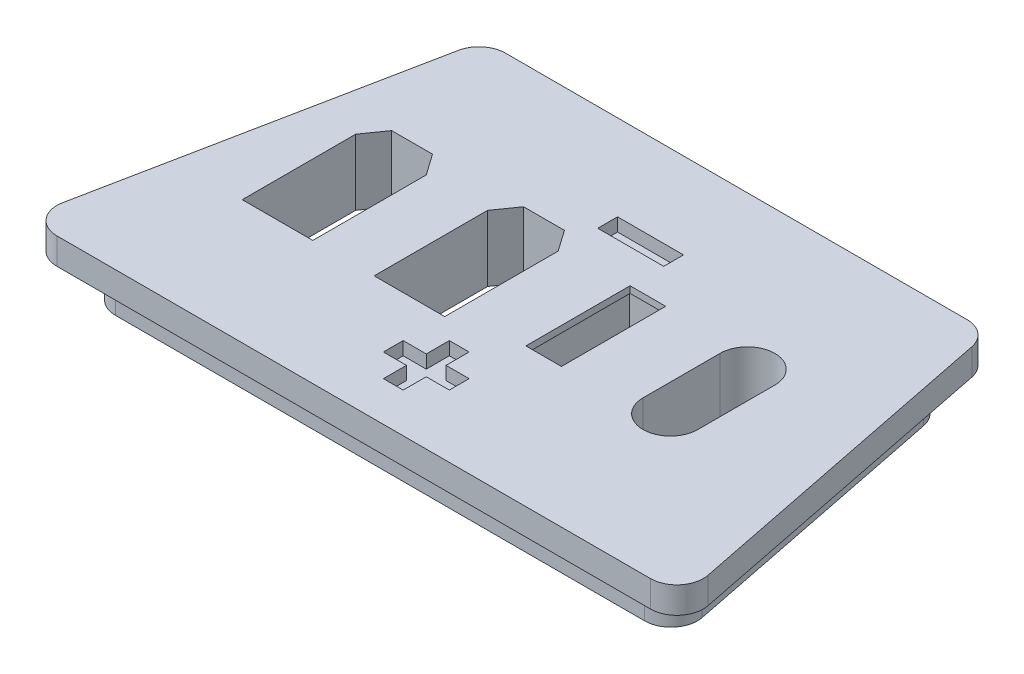
from build123d import *

# Parameters (mm, degrees)
BOSS_EXTRUDE1_DEPTH = 3
BOSS_EXTRUDE2_DEPTH = 2
FILLET1_R           = 2
CUT_EXTRUDE1_DEPTH  = 5
LPATTERN1_COUNT     = 2
LPATTERN1_PITCH     = 10
SKETCH5_W           = 2.7
SKETCH5_H           = 7.9
CUT_EXTRUDE2_DEPTH  = 5
SKETCH6_W           = 3
SKETCH6_H           = 8.1
CUT_EXTRUDE3_DEPTH  = 4.5
USB_C_HOLE_DEPTH    = 5
SKETCH8_W           = 1.75
SKETCH8_H           = 1.5
SKETCH8_W_2         = 1.5
SKETCH8_H_2         = 1.75
SKETCH8_W_3         = 5
POSNEGSIGNS_DEPTH   = 1


with BuildPart() as part:
    # Sketch1 → Boss-Extrude1 (new body)
    with BuildSketch(Plane(origin=(0, 0, 0), x_dir=(1, 0, 0), z_dir=(0, 1, 0))):
        Polygon((-17.5, 12.5), (17.5, 12.5), (22.5, -12.5), (-22.5, -12.5), align=None)
    extrude(amount=BOSS_EXTRUDE1_DEPTH)

    # Sketch2 → Boss-Extrude2 (add)
    with BuildSketch(Plane(origin=(0, 3, 0), x_dir=(1, 0, 0), z_dir=(0, 1, 0))):
        Polygon((-19.139607805, 14.5), (19.139607805, 14.5), (24.939607805, -14.5), (-24.939607805, -14.5), align=None)
    extrude(amount=BOSS_EXTRUDE2_DEPTH)

    # Fillet1
    fillet1_edges = [part.edges().sort_by_distance(p)[0] for p in [
        (-19.139607805, 4, -14.5),
        (-24.939607805, 4, 14.5),
        (24.939607805, 4, 14.5),
        (19.139607805, 4, -14.5),
        (-17.5, 1.5, -12.5),
        (17.5, 1.5, -12.5),
        (22.5, 1.5, 12.5),
        (-22.5, 1.5, 12.5),
    ]]
    fillet(fillet1_edges, radius=FILLET1_R)

    # Sketch3 → Cut-Extrude1 (cut)
    with BuildSketch(Plane(origin=(0, 5, 0), x_dir=(1, 0, 0), z_dir=(0, 1, 0))):
        Polygon((-7.85, -5.1), (-2.5, -5.1), (-2.5, 3.5), (-3.625, 5.1), (-6.725, 5.1), (-7.85, 3.5), align=None)
    cut_extrude1 = extrude(amount=-CUT_EXTRUDE1_DEPTH, mode=Mode.SUBTRACT)

    # LPattern1: Cut-Extrude1 ×2
    with Locations(*[(-i * LPATTERN1_PITCH, 0, 0) for i in range(1, LPATTERN1_COUNT)]):
        add(cut_extrude1, mode=Mode.SUBTRACT)

    # Sketch5 → Cut-Extrude2 (cut)
    with BuildSketch(Plane.XZ):
        with Locations((3.85, 0)):
            Rectangle(SKETCH5_W, SKETCH5_H)
    extrude(amount=-CUT_EXTRUDE2_DEPTH, mode=Mode.SUBTRACT)

    # Sketch6 → Cut-Extrude3 (cut)
    with BuildSketch(Plane.XZ):
        with Locations((3.85, 0)):
            Rectangle(SKETCH6_W, SKETCH6_H)
    extrude(amount=-CUT_EXTRUDE3_DEPTH, mode=Mode.SUBTRACT)

    # Sketch7 → USB-C Hole (cut)
    with BuildSketch(Plane.XZ):
        with BuildLine():
            Line((14.51, 2.92), (14.51, -2.92))
            ThreePointArc((14.51, -2.92), (12.43, -5), (10.35, -2.92))
            Line((10.35, -2.92), (10.35, 2.92))
            ThreePointArc((10.35, 2.92), (12.43, 5), (14.51, 2.92))
        make_face()
    extrude(amount=-USB_C_HOLE_DEPTH, mode=Mode.SUBTRACT)

    # Sketch8 → PosNegSigns (cut)
    with BuildSketch(Plane(origin=(0, 5, 0), x_dir=(1, 0, 0), z_dir=(0, 1, 0))):
        with Locations((-1.625, -9)):
            Rectangle(SKETCH8_W, SKETCH8_H)
        with Locations((0, -10.625)):
            Rectangle(SKETCH8_W_2, SKETCH8_H_2)
        with Locations((0, -9)):
            Rectangle(SKETCH8_W_2, SKETCH8_H)
        with Locations((1.625, -9)):
            Rectangle(SKETCH8_W, SKETCH8_H)
        with Locations((0, -7.375)):
            Rectangle(SKETCH8_W_2, SKETCH8_H_2)
        with Locations((0, 7.25)):
            Rectangle(SKETCH8_W_3, SKETCH8_H)
    extrude(amount=-POSNEGSIGNS_DEPTH, mode=Mode.SUBTRACT)


solid = part.part
